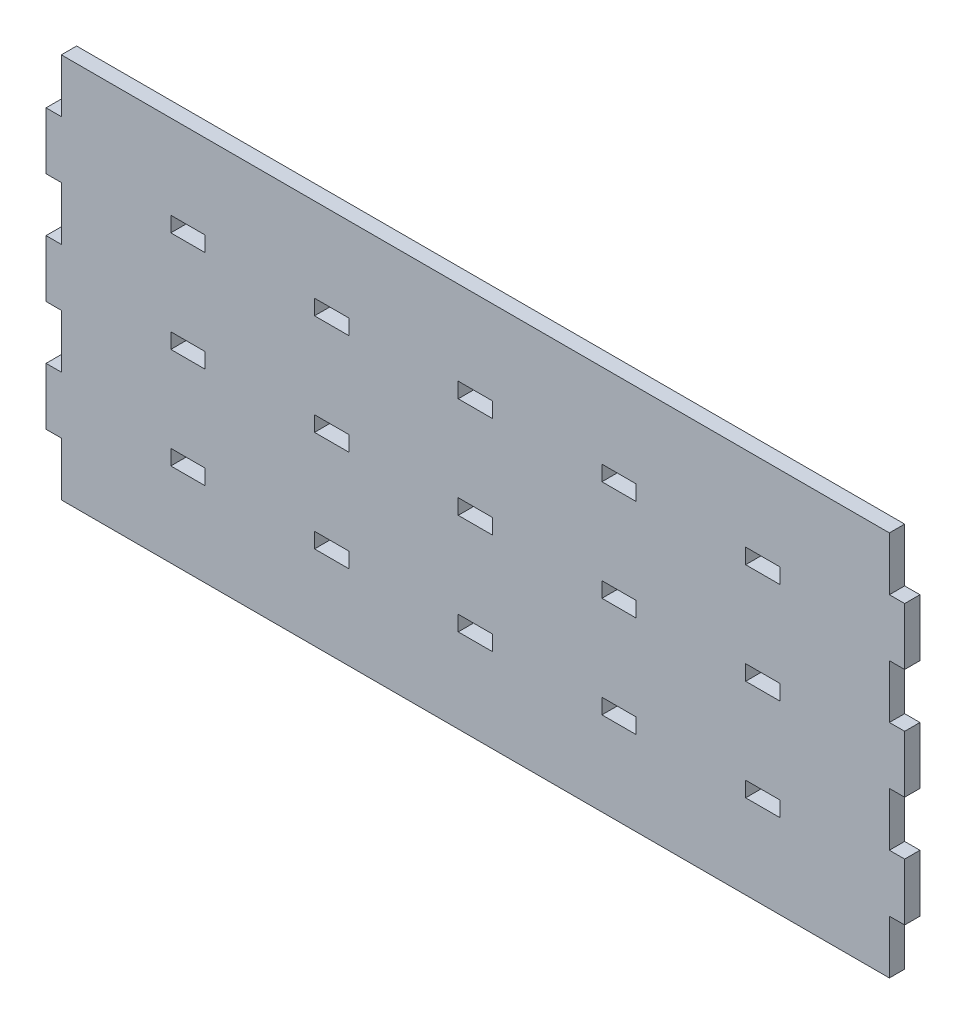
from build123d import *

# Parameters (mm, degrees)
MODEL_W             = 12
MODEL_H             = 5.35
BOSS_EXTRUDE1_DEPTH = 5.35


with BuildPart() as part:
    # Model → Boss-Extrude1 (new body)
    with BuildSketch(Plane.XY):
        Polygon((0, 116.25), (0, 135), (290, 135), (290, 116.25), (295.35, 116.25), (295.35, 96.25), (290, 96.25), (290, 77.5), (295.35, 77.5), (295.35, 57.5), (290, 57.5), (290, 38.75), (295.35, 38.75), (295.35, 18.75), (290, 18.75), (290, 0), (0, 0), (0, 18.75), (-5.35, 18.75), (-5.35, 38.75), (0, 38.75), (0, 57.5), (-5.35, 57.5), (-5.35, 77.5), (0, 77.5), (0, 96.25), (-5.35, 96.25), (-5.35, 116.25), align=None)
        with Locations((195.33, 102.85)):
            Rectangle(MODEL_W, MODEL_H, mode=Mode.SUBTRACT)
        with Locations((145, 102.85)):
            Rectangle(MODEL_W, MODEL_H, mode=Mode.SUBTRACT)
        with Locations((245.66, 102.85)):
            Rectangle(MODEL_W, MODEL_H, mode=Mode.SUBTRACT)
        with Locations((195.33, 67.5)):
            Rectangle(MODEL_W, MODEL_H, mode=Mode.SUBTRACT)
        with Locations((245.66, 67.5)):
            Rectangle(MODEL_W, MODEL_H, mode=Mode.SUBTRACT)
        with Locations((195.33, 32.15)):
            Rectangle(MODEL_W, MODEL_H, mode=Mode.SUBTRACT)
        with Locations((245.66, 32.15)):
            Rectangle(MODEL_W, MODEL_H, mode=Mode.SUBTRACT)
        with Locations((145, 67.5)):
            Rectangle(MODEL_W, MODEL_H, mode=Mode.SUBTRACT)
        with Locations((145, 32.15)):
            Rectangle(MODEL_W, MODEL_H, mode=Mode.SUBTRACT)
        with Locations((94.67, 102.85)):
            Rectangle(MODEL_W, MODEL_H, mode=Mode.SUBTRACT)
        with Locations((44.34, 102.85)):
            Rectangle(MODEL_W, MODEL_H, mode=Mode.SUBTRACT)
        with Locations((94.67, 67.5)):
            Rectangle(MODEL_W, MODEL_H, mode=Mode.SUBTRACT)
        with Locations((44.34, 67.5)):
            Rectangle(MODEL_W, MODEL_H, mode=Mode.SUBTRACT)
        with Locations((94.67, 32.15)):
            Rectangle(MODEL_W, MODEL_H, mode=Mode.SUBTRACT)
        with Locations((44.34, 32.15)):
            Rectangle(MODEL_W, MODEL_H, mode=Mode.SUBTRACT)
    extrude(amount=BOSS_EXTRUDE1_DEPTH)


solid = part.part
